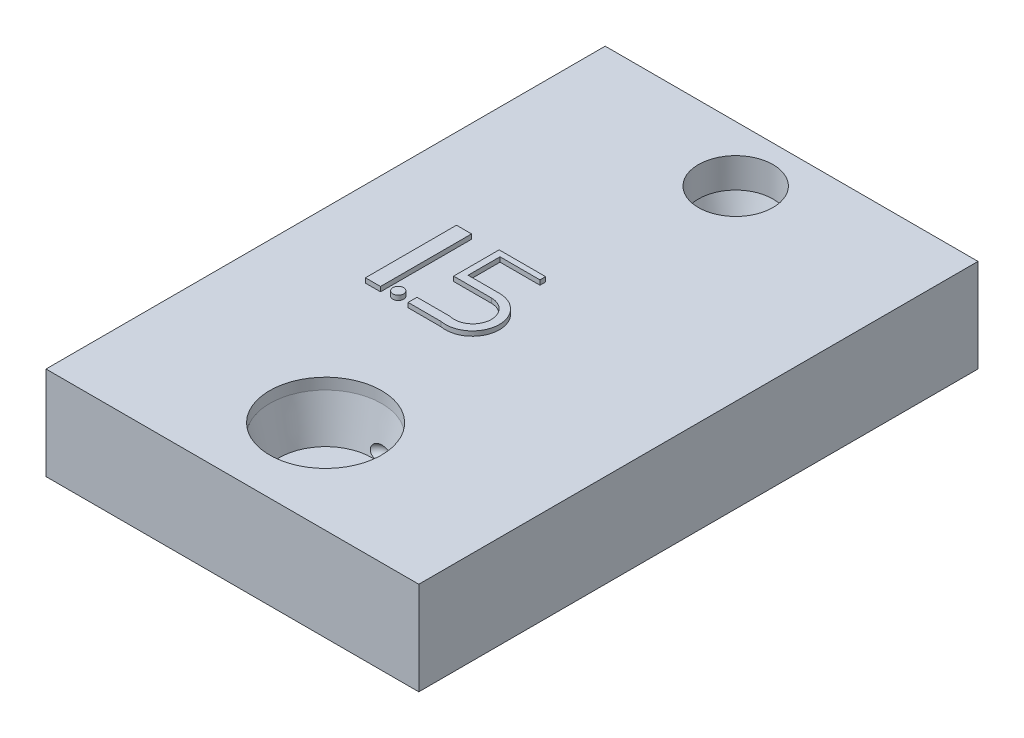
from build123d import *

# Parameters (mm, degrees)
SKETCH1_W           = 40
SKETCH1_H           = 10
BOSS_EXTRUDE1_DEPTH = 60
SKETCH10_R          = 0.75
SKETCH15_R          = 0.582795882
SKETCH15_W          = 1.615885855
SKETCH15_H          = 9.768764268
BOSS_EXTRUDE2_DEPTH = 0.5


with BuildPart() as part:
    # Sketch1 → Boss-Extrude1 (new body)
    with BuildSketch(Plane.XY):
        Rectangle(SKETCH1_W, SKETCH1_H)
    extrude(amount=BOSS_EXTRUDE1_DEPTH)

    # Cut-Sweep1: sweep along a path in Sketch2
    with BuildLine(Plane(origin=(0, 0, 0), x_dir=(1, 0, 0), z_dir=(0, 1, 0))) as cut_sweep1_path:
        Line((0, -50), (0, -46))
        ThreePointArc((0, -46), (0.292893219, -45.292893219), (1, -45))
        Line((1, -45), (15, -45))
        ThreePointArc((15, -45), (16.5, -43.5), (15, -42))
        Line((15, -42), (0, -42))
        Line((0, -42), (-15, -42))
        ThreePointArc((-15, -42), (-16.5, -40.5), (-15, -39))
        Line((-15, -39), (15, -39))
        ThreePointArc((15, -39), (16.5, -37.5), (15, -36))
        Line((15, -36), (-15, -36))
        ThreePointArc((-15, -36), (-16.5, -34.5), (-15, -33))
        Line((-15, -33), (15.355579664, -33))
        ThreePointArc((15.355579664, -33), (16.855579664, -31.5), (15.355579664, -30))
        Line((15.355579664, -30), (-15, -30))
        ThreePointArc((-15, -30), (-16.5, -28.5), (-15, -27))
        Line((-15, -27), (15, -27))
        ThreePointArc((15, -27), (16.5, -25.5), (15, -24))
        Line((15, -24), (-15, -24))
        ThreePointArc((-15, -24), (-16.5, -22.5), (-15, -21))
        Line((-15, -21), (15, -21))
        ThreePointArc((15, -21), (16.5, -19.5), (15, -18))
        Line((15, -18), (-15, -18))
        ThreePointArc((-15, -18), (-16.5, -16.5), (-15, -15))
        Line((-15, -15), (15, -15))
        ThreePointArc((15, -15), (16.5, -13.5), (15, -12))
        Line((15, -12), (1, -12))
        ThreePointArc((1, -12), (0.292893219, -11.707106781), (0, -11))
        Line((0, -11), (0, -6))
    # Sketch10 → Cut-Sweep1 (sweep, cut)
    with BuildSketch(Plane(origin=(0, 0, 6), x_dir=(-1, 0, 0), z_dir=(0, 0, -1))):
        Circle(SKETCH10_R)
    sweep(path=cut_sweep1_path.line, mode=Mode.SUBTRACT)

    # Sketch13 → Cut-Revolve1 (revolve, cut)
    with BuildSketch(Plane(origin=(0, 0, 0), x_dir=(0, 0, -1), z_dir=(1, 0, 0)), mode=Mode.PRIVATE) as cut_revolve1_sk:
        Polygon((-50, -0.75), (-55, -0.75), (-56, 3.8), (-56, 29.25), (-50, 29.25), align=None)
    revolve(cut_revolve1_sk.sketch.rotate(Axis((0, -0.75, 50), (0, 1, 0)), 168.466450316), axis=Axis((0, -0.75, 50), (0, 1, 0)), mode=Mode.SUBTRACT)

    # Sketch14 → Cut-Revolve2 (revolve, cut)
    with BuildSketch(Plane(origin=(0, 0, 0), x_dir=(0, 0, -1), z_dir=(1, 0, 0)), mode=Mode.PRIVATE) as cut_revolve2_sk:
        Polygon((-6, -0.75), (-3, -0.75), (-2, 1.8), (-2, 29.25), (-6, 29.25), align=None)
    revolve(cut_revolve2_sk.sketch.rotate(Axis((0, -0.75, 6), (0, 1, 0)), 180), axis=Axis((0, -0.75, 6), (0, 1, 0)), mode=Mode.SUBTRACT)

    # Sketch15 → Boss-Extrude2 (add)
    with BuildSketch(Plane(origin=(0, 5, 0), x_dir=(1, 0, 0), z_dir=(0, 1, 0))):
        with Locations(Location((-7.872848483, -34.330964939, 0), (0, 0, 90))):
            Circle(SKETCH15_R)
        with BuildLine():
            Line((-1.279242968, -25.115617866), (-6.261557686, -25.115617866))
            Line((-6.261557686, -25.115617866), (-6.261557686, -30))
            Line((-6.261557686, -30), (-2.209050194, -30))
            ThreePointArc((-2.209050194, -30), (-0.227959278, -32.255756267), (-2.720619072, -33.929017964))
            Line((-2.720619072, -33.929017964), (-6.261557686, -33.929017964))
            Line((-6.261557686, -33.929017964), (-6.261557686, -34.884382134))
            Line((-6.261557686, -34.884382134), (-2.720619072, -34.884382134))
            ThreePointArc((-2.720619072, -34.884382134), (0.673414767, -32.292873742), (-2.209050194, -29.142194895))
            Line((-2.209050194, -29.142194895), (-5.570788533, -29.142194895))
            Line((-5.570788533, -29.142194895), (-5.570788533, -27.557808933))
            Line((-5.570788533, -27.557808933), (-5.570788533, -25.715617866))
            Line((-5.570788533, -25.715617866), (-1.279242968, -25.715617866))
            Line((-1.279242968, -25.715617866), (-1.279242968, -25.115617866))
        make_face()
        with Locations((-10.031958014, -30)):
            Rectangle(SKETCH15_W, SKETCH15_H)
    extrude(amount=BOSS_EXTRUDE2_DEPTH)


solid = part.part
